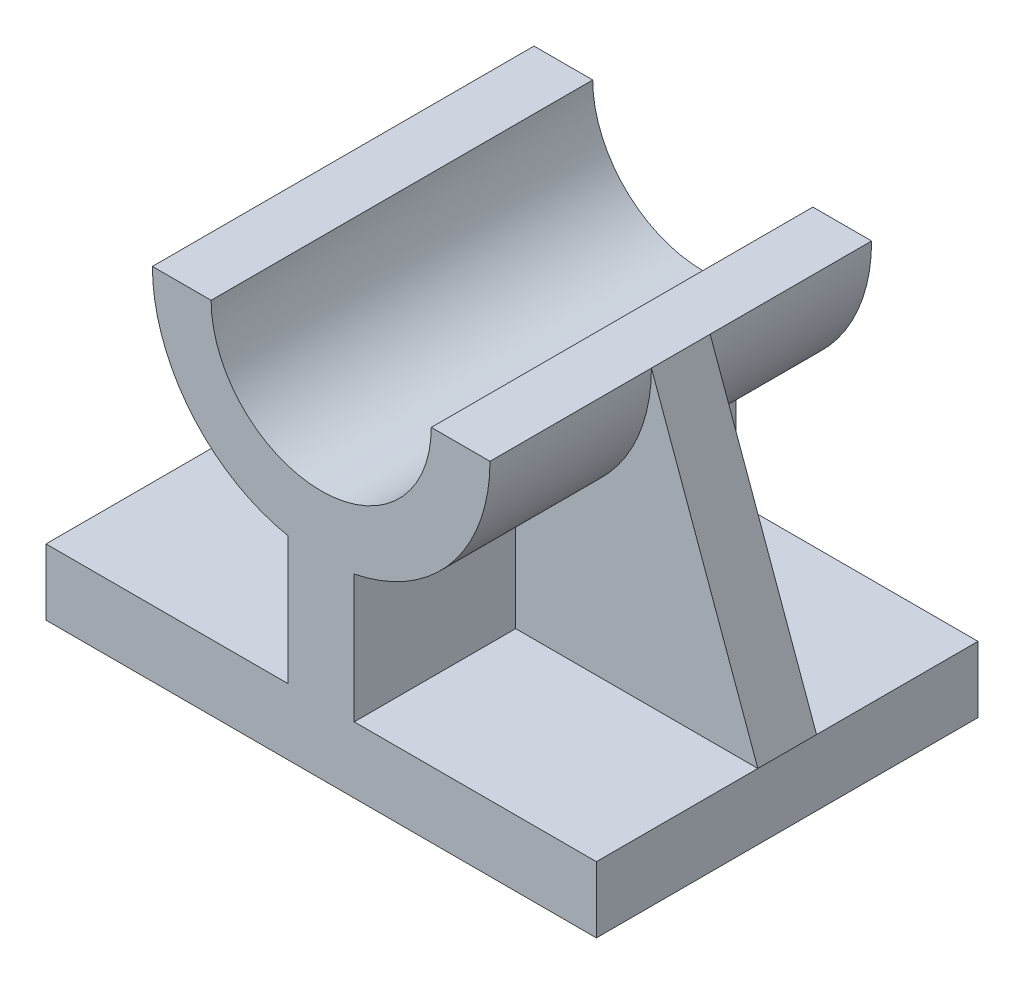
from build123d import *

# Parameters (mm, degrees)
SKETCH1_W           = 75
SKETCH1_H           = 52
BOSS_EXTRUDE1_DEPTH = 9
BOSS_EXTRUDE2_DEPTH = 52
RIB1_REACH          = 68.957
SKETCH3_WALL_W      = 178.461184404
SKETCH3_WALL_H      = 8


with BuildPart() as part:
    # Sketch1 → Boss-Extrude1 (new body)
    with BuildSketch(Plane(origin=(0, 0, 0), x_dir=(1, 0, 0), z_dir=(0, 1, 0))):
        Rectangle(SKETCH1_W, SKETCH1_H)
    extrude(amount=BOSS_EXTRUDE1_DEPTH)

    # Sketch2 → Boss-Extrude2 (add)
    with BuildSketch(Plane.XY.offset(26)):
        with BuildLine():
            Line((4.5, 34.690911979), (4.5, 26.444512863))
            ThreePointArc((4.5, 26.444512863), (17.783419244, 34.414047854), (23, 49))
            Line((23, 49), (15, 49))
            ThreePointArc((15, 49), (12.093386622, 40.125880325), (4.5, 34.690911979))
        make_face()
        with BuildLine():
            ThreePointArc((-23, 49), (-17.783419244, 34.414047854), (-4.5, 26.444512863))
            Line((-4.5, 26.444512863), (-4.5, 34.690911979))
            ThreePointArc((-4.5, 34.690911979), (-12.093386622, 40.125880325), (-15, 49))
            Line((-15, 49), (-23, 49))
        make_face()
        with BuildLine():
            Line((-4.5, 34.690911979), (-4.5, 26.444512863))
            ThreePointArc((-4.5, 26.444512863), (0, 26), (4.5, 26.444512863))
            Line((4.5, 26.444512863), (4.5, 34.690911979))
            ThreePointArc((4.5, 34.690911979), (0, 34), (-4.5, 34.690911979))
        make_face()
        with BuildLine():
            Line((-4.5, 26.444512863), (-4.5, 9))
            Line((-4.5, 9), (4.5, 9))
            Line((4.5, 9), (4.5, 26.444512863))
            ThreePointArc((4.5, 26.444512863), (0, 26), (-4.5, 26.444512863))
        make_face()
    extrude(amount=-BOSS_EXTRUDE2_DEPTH)

    # Sketch3 wall → Rib1 (add, up to next)
    with BuildSketch(Plane(origin=(30.25, 29, 0), x_dir=(0.340799323621, -0.940136065162, 0), z_dir=(0.940136065162, 0.340799323621, 0)), mode=Mode.PRIVATE) as rib1_sk1:
        Rectangle(SKETCH3_WALL_W, SKETCH3_WALL_H)
    rib1_tool1 = extrude(rib1_sk1.sketch, amount=-RIB1_REACH, mode=Mode.PRIVATE) - part.part
    add(rib1_tool1.solids().sort_by_distance((30.25, 29, 0))[0])


solid = part.part
